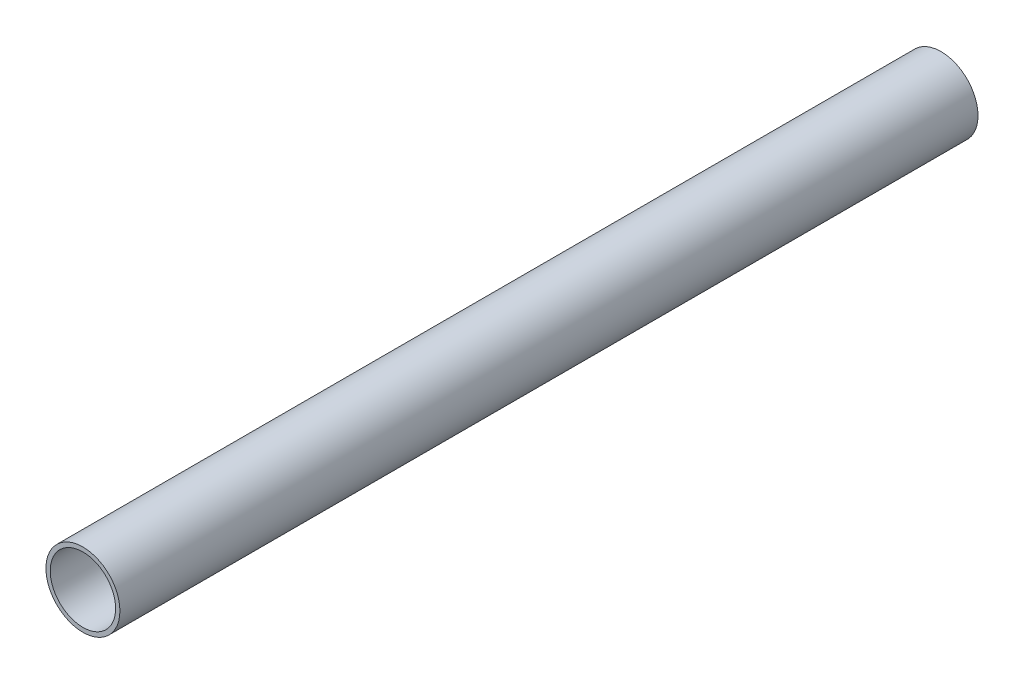
from build123d import *

# Parameters (mm, degrees)
CROQUIS1_R              = 86.2
CROQUIS1_R_2            = 76.2
SALIENTE_EXTRUIR1_DEPTH = 2000


with BuildPart() as part:
    # Croquis1 → Saliente-Extruir1 (new body)
    with BuildSketch(Plane.XY):
        Circle(CROQUIS1_R)
        Circle(CROQUIS1_R_2, mode=Mode.SUBTRACT)
    extrude(amount=-SALIENTE_EXTRUIR1_DEPTH)


solid = part.part
